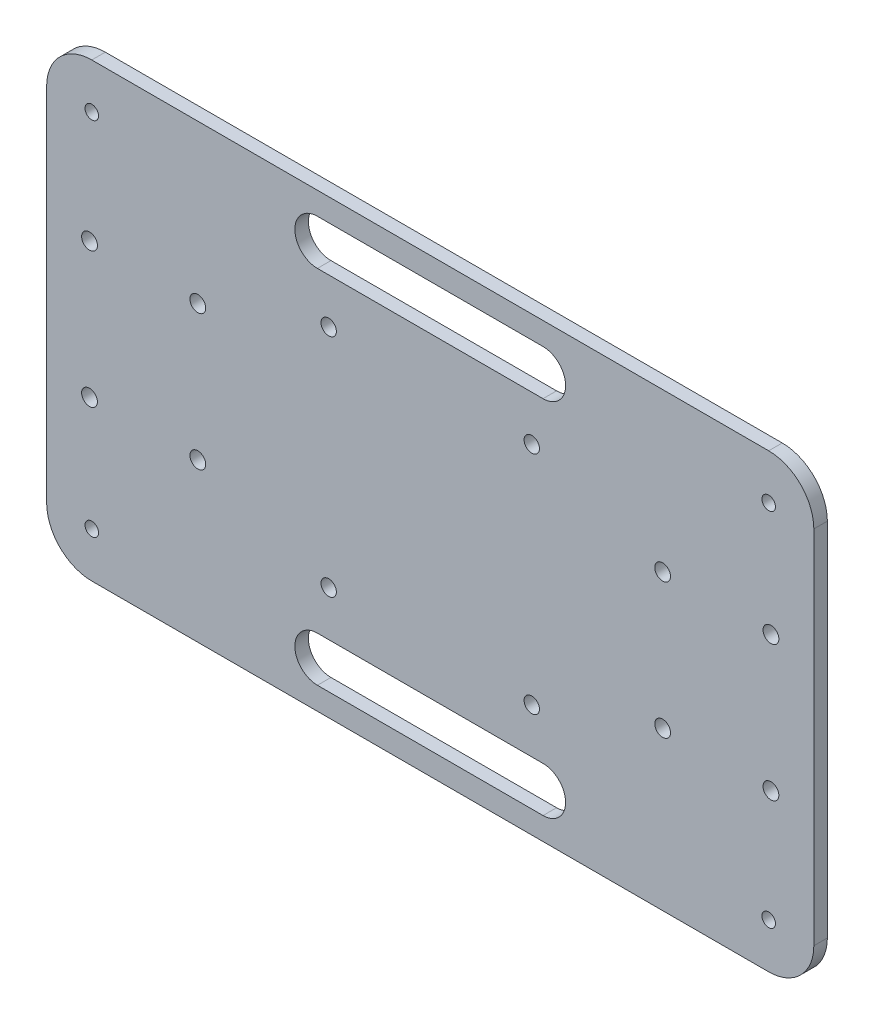
from build123d import *

# Parameters (mm, degrees)
SKETCH1_R           = 1.75
SKETCH1_R_2         = 1.5
SKETCH1_R_3         = 1.7
BOSS_EXTRUDE1_DEPTH = 3


with BuildPart() as part:
    # Sketch1 → Boss-Extrude1 (new body)
    with BuildSketch(Plane.XY):
        with BuildLine():
            Line((-75, 50), (75, 50))
            ThreePointArc((75, 50), (82.071067812, 47.071067812), (85, 40))
            Line((85, 40), (85, -40))
            ThreePointArc((85, -40), (82.071067812, -47.071067812), (75, -50))
            Line((75, -50), (-75, -50))
            ThreePointArc((-75, -50), (-82.071067812, -47.071067812), (-85, -40))
            Line((-85, -40), (-85, 40))
            ThreePointArc((-85, 40), (-82.071067812, 47.071067812), (-75, 50))
        make_face()
        with Locations((-75.5, 15)):
            Circle(SKETCH1_R, mode=Mode.SUBTRACT)
        with Locations((-75.5, -15)):
            Circle(SKETCH1_R, mode=Mode.SUBTRACT)
        with Locations((-51.5, -15)):
            Circle(SKETCH1_R, mode=Mode.SUBTRACT)
        with Locations((-51.5, 15)):
            Circle(SKETCH1_R, mode=Mode.SUBTRACT)
        with Locations((75.5, -15)):
            Circle(SKETCH1_R, mode=Mode.SUBTRACT)
        with Locations((51.5, -15)):
            Circle(SKETCH1_R, mode=Mode.SUBTRACT)
        with Locations((51.5, 15)):
            Circle(SKETCH1_R, mode=Mode.SUBTRACT)
        with Locations((75.5, 15)):
            Circle(SKETCH1_R, mode=Mode.SUBTRACT)
        with Locations((-75, -40)):
            Circle(SKETCH1_R_2, mode=Mode.SUBTRACT)
        with Locations((-75, 40)):
            Circle(SKETCH1_R_2, mode=Mode.SUBTRACT)
        with Locations((75, 40)):
            Circle(SKETCH1_R_2, mode=Mode.SUBTRACT)
        with Locations((75, -40)):
            Circle(SKETCH1_R_2, mode=Mode.SUBTRACT)
        with Locations((-22.5, 25)):
            Circle(SKETCH1_R_3, mode=Mode.SUBTRACT)
        with Locations((22.5, 25)):
            Circle(SKETCH1_R_3, mode=Mode.SUBTRACT)
        with Locations((22.5, -25)):
            Circle(SKETCH1_R_3, mode=Mode.SUBTRACT)
        with Locations((-22.5, -25)):
            Circle(SKETCH1_R_3, mode=Mode.SUBTRACT)
        with BuildLine():
            Line((-25, 45), (25, 45))
            ThreePointArc((25, 45), (30, 40), (25, 35))
            Line((25, 35), (-25, 35))
            ThreePointArc((-25, 35), (-30, 40), (-25, 45))
        make_face(mode=Mode.SUBTRACT)
        with BuildLine():
            Line((-25, -45), (25, -45))
            ThreePointArc((25, -45), (30, -40), (25, -35))
            Line((25, -35), (-25, -35))
            ThreePointArc((-25, -35), (-30, -40), (-25, -45))
        make_face(mode=Mode.SUBTRACT)
    extrude(amount=BOSS_EXTRUDE1_DEPTH)


solid = part.part
